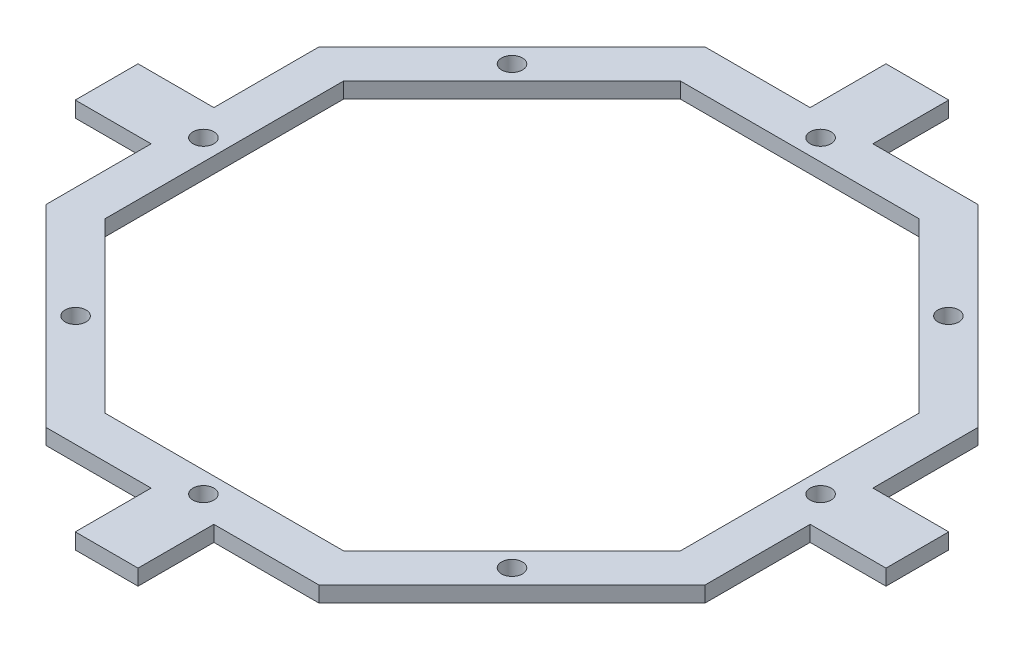
from build123d import *

# Parameters (mm, degrees)
BOSS_EXTRUDE1_DEPTH     = 3
CUT_EXTRUDE1_DEPTH      = 84
CUT_EXTRUDE1_DEPTH_BACK = 76
SKETCH3_R               = 2


with BuildPart() as part:
    # Sketch2 → Boss-Extrude1 (new body)
    with BuildSketch(Plane(origin=(0, 0, 0), x_dir=(1, 0, 0), z_dir=(0, 1, 0))):
        Polygon((6, -77.5), (6, -63), (26.09545443, -63), (63, -26.09545443), (63, -6), (77.5, -6), (77.5, 6), (63, 6), (63, 26.09545443), (26.09545443, 63), (6, 63), (6, 77.5), (-6, 77.5), (-6, 63), (-26.09545443, 63), (-63, 26.09545443), (-63, 6), (-77.5, 6), (-77.5, -6), (-63, -6), (-63, -26.09545443), (-26.09545443, -63), (-6, -63), (-6, -77.5), align=None)
        Polygon((22.781745931, -55), (55, -22.781745931), (55, 22.781745931), (22.781745931, 55), (-22.781745931, 55), (-55, 22.781745931), (-55, -22.781745931), (-22.781745931, -55), align=None, mode=Mode.SUBTRACT)
    extrude(amount=BOSS_EXTRUDE1_DEPTH)

    # Sketch3 → Cut-Extrude1 (cut, two sides: drawn at the far end of the back side and taken through both)
    with BuildSketch(Plane(origin=(0, 3, 0), x_dir=(1, 0, 0), z_dir=(0, 1, 0)).offset(-CUT_EXTRUDE1_DEPTH_BACK)):
        with Locations(Location((0, 59, 0), (0, 0, 270))):
            Circle(SKETCH3_R)
        with Locations(Location((41.71930009, 41.71930009, 0), (0, 0, 270))):
            Circle(SKETCH3_R)
        with Locations(Location((59, 0, 0), (0, 0, 270))):
            Circle(SKETCH3_R)
        with Locations(Location((41.71930009, -41.71930009, 0), (0, 0, 270))):
            Circle(SKETCH3_R)
        with Locations(Location((0, -59, 0), (0, 0, 270))):
            Circle(SKETCH3_R)
        with Locations(Location((-41.71930009, -41.71930009, 0), (0, 0, 270))):
            Circle(SKETCH3_R)
        with Locations(Location((-59, 0, 0), (0, 0, 270))):
            Circle(SKETCH3_R)
        with Locations(Location((-41.71930009, 41.71930009, 0), (0, 0, 270))):
            Circle(SKETCH3_R)
    extrude(amount=CUT_EXTRUDE1_DEPTH + CUT_EXTRUDE1_DEPTH_BACK, mode=Mode.SUBTRACT)


solid = part.part
